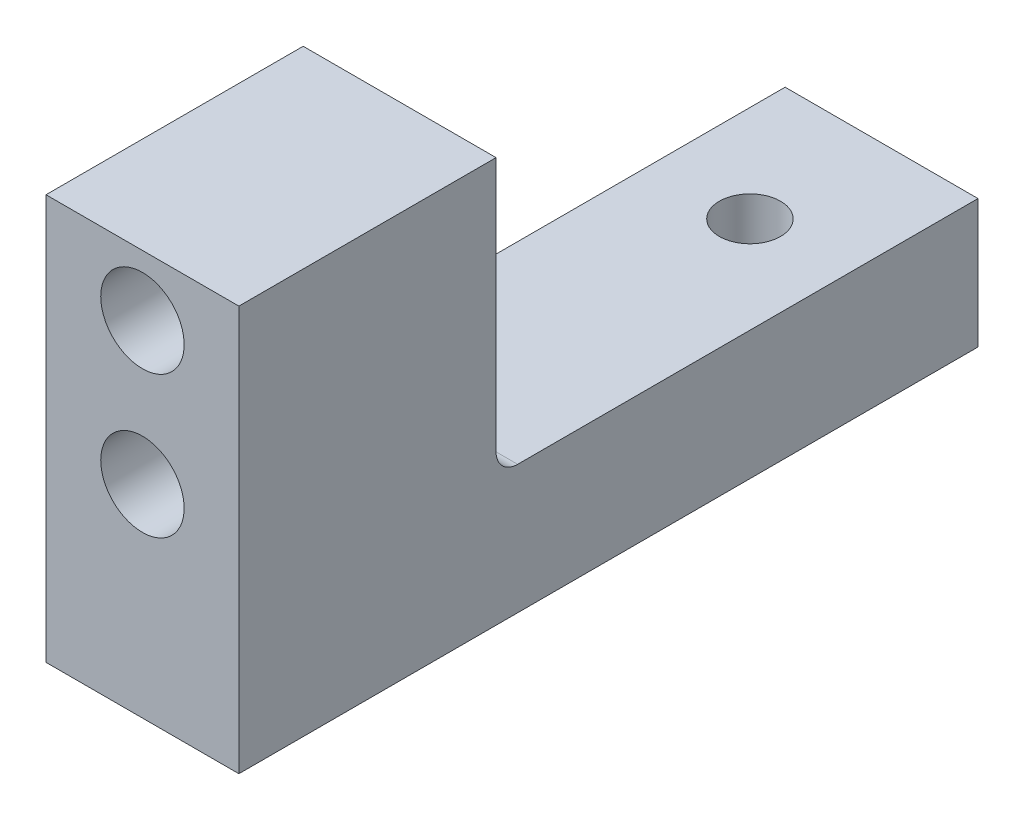
from build123d import *

# Parameters (mm, degrees)
SKETCH1_W                 = 18.25
SKETCH1_H                 = 10
BOSS_EXTRUDE1_DEPTH       = 4.7625
F_1_64_TAPPED_HOLE1_D     = 1.5113
F_1_64_TAPPED_HOLE1_DEPTH = 3.5
F_1_64_TAPPED_HOLE1_TIP   = 0.454040327
SKETCH5_W                 = 11.9
SKETCH5_H                 = 6.825
CUT_EXTRUDE2_DEPTH        = 10
FILLET1_R                 = 0.5334
SKETCH2_R                 = 1.03
CUT_EXTRUDE1_DEPTH        = 20.512660153


with BuildPart() as part:
    # Sketch1 → Boss-Extrude1 (new body)
    with BuildSketch(Plane(origin=(0, 0, 0), x_dir=(0, 0, -1), z_dir=(1, 0, 0))):
        Rectangle(SKETCH1_W, SKETCH1_H)
    extrude(amount=BOSS_EXTRUDE1_DEPTH)

    # #1-64 Tapped Hole1
    with Locations(Plane(origin=(0, -5, 0), x_dir=(-1, 0, 0), z_dir=(0, -1, 0))):
        with Locations((-2.38125, -6.125), (-2.38125, 5.875)):
            Hole(F_1_64_TAPPED_HOLE1_D / 2, depth=F_1_64_TAPPED_HOLE1_DEPTH)
            with Locations((0, 0, -(F_1_64_TAPPED_HOLE1_DEPTH + F_1_64_TAPPED_HOLE1_TIP / 2))):  # 118° drill point
                Cone(0, F_1_64_TAPPED_HOLE1_D / 2, F_1_64_TAPPED_HOLE1_TIP, mode=Mode.SUBTRACT)

    # Sketch5 → Cut-Extrude2 (cut)
    with BuildSketch(Plane(origin=(4.7625, 0, 0), x_dir=(0, 0, -1), z_dir=(1, 0, 0))):
        with Locations((3.175, 1.5875)):
            Rectangle(SKETCH5_W, SKETCH5_H)
    extrude(amount=-CUT_EXTRUDE2_DEPTH, mode=Mode.SUBTRACT)

    # Fillet1
    fillet1_edges = [part.edges().sort_by_distance(p)[0] for p in [
        (2.38125, -1.825, 2.775),
    ]]
    fillet(fillet1_edges, radius=FILLET1_R)

    # Sketch2 → Cut-Extrude1 (cut, through all)
    with BuildSketch(Plane(origin=(0, 0, -9.125), x_dir=(-1, 0, 0), z_dir=(0, 0, -1))):
        with Locations((-2.38125, 3.5)):
            Circle(SKETCH2_R)
        with Locations((-2.38125, 0)):
            Circle(SKETCH2_R)
    extrude(amount=-CUT_EXTRUDE1_DEPTH, mode=Mode.SUBTRACT)


solid = part.part
